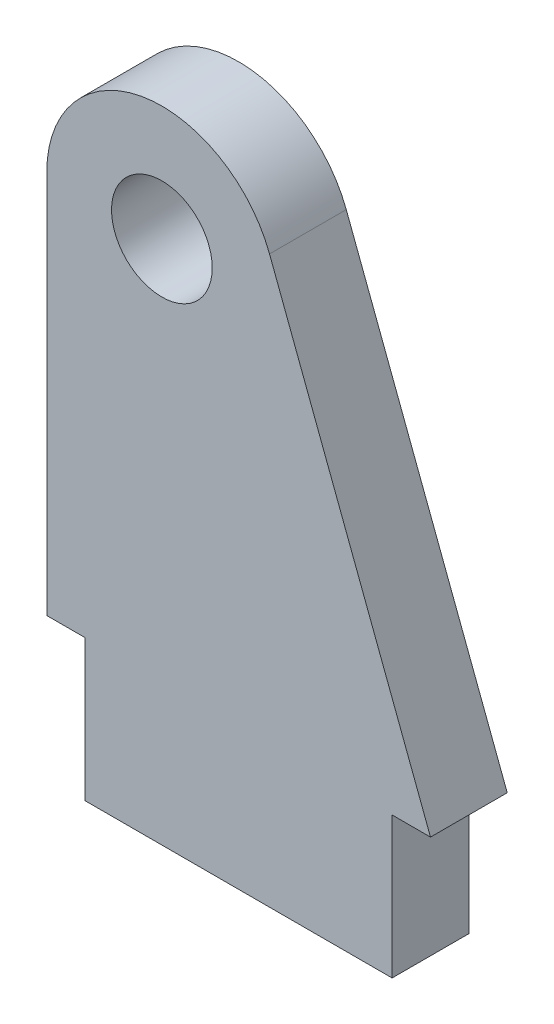
from build123d import *

# Parameters (mm, degrees)
SKETCH1_R           = 2.0828
BOSS_EXTRUDE1_DEPTH = 3.175


with BuildPart() as part:
    # Sketch1 → Boss-Extrude1 (new body)
    with BuildSketch(Plane.XY):
        with BuildLine():
            Line((7.9375, 2.921), (1.278148318, 20.484453822))
            ThreePointArc((1.278148318, 20.484453822), (-4.033279496, 23.480523728), (-7.9375, 18.796))
            Line((-7.9375, 18.796), (-7.9375, 2.921))
            Line((-7.9375, 2.921), (-6.35, 2.921))
            Line((-6.35, 2.921), (-6.35, -2.921))
            Line((-6.35, -2.921), (6.35, -2.921))
            Line((6.35, -2.921), (6.35, 2.921))
            Line((6.35, 2.921), (7.9375, 2.921))
        make_face()
        with Locations((-3.175, 18.796)):
            Circle(SKETCH1_R, mode=Mode.SUBTRACT)
    extrude(amount=BOSS_EXTRUDE1_DEPTH)


solid = part.part
